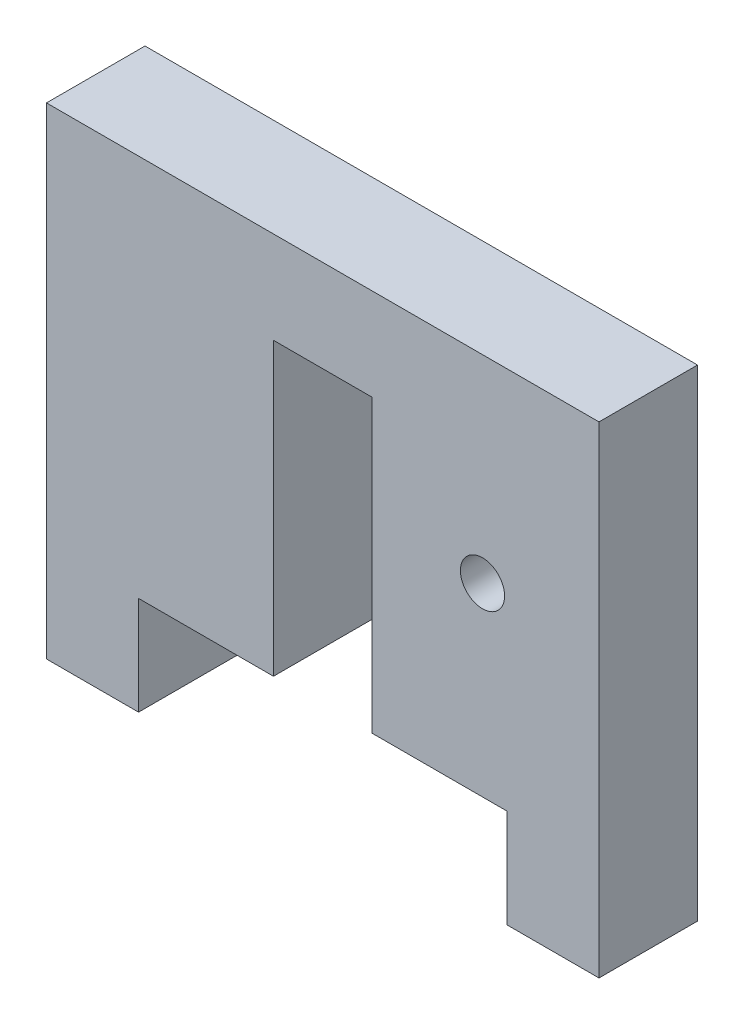
from build123d import *

# Parameters (mm, degrees)
MODEL_R             = 1.2
BOSS_EXTRUDE1_DEPTH = 5.35


with BuildPart() as part:
    # Model → Boss-Extrude1 (new body)
    with BuildSketch(Plane.XY):
        Polygon((29.999999329, 26.14999935), (29.999999329, 0), (24.999999441, 0), (24.999999441, 5.350000225), (17.674999312, 5.350000225), (17.674999312, 21.150000393), (12.325000018, 21.150000393), (12.325000018, 5.350000225), (4.999998957, 5.350000225), (4.999998957, 0), (0, 0), (0, 26.14999935), align=None)
        with Locations((23.674999329, 15.4)):
            Circle(MODEL_R, mode=Mode.SUBTRACT)
    extrude(amount=BOSS_EXTRUDE1_DEPTH)


solid = part.part
